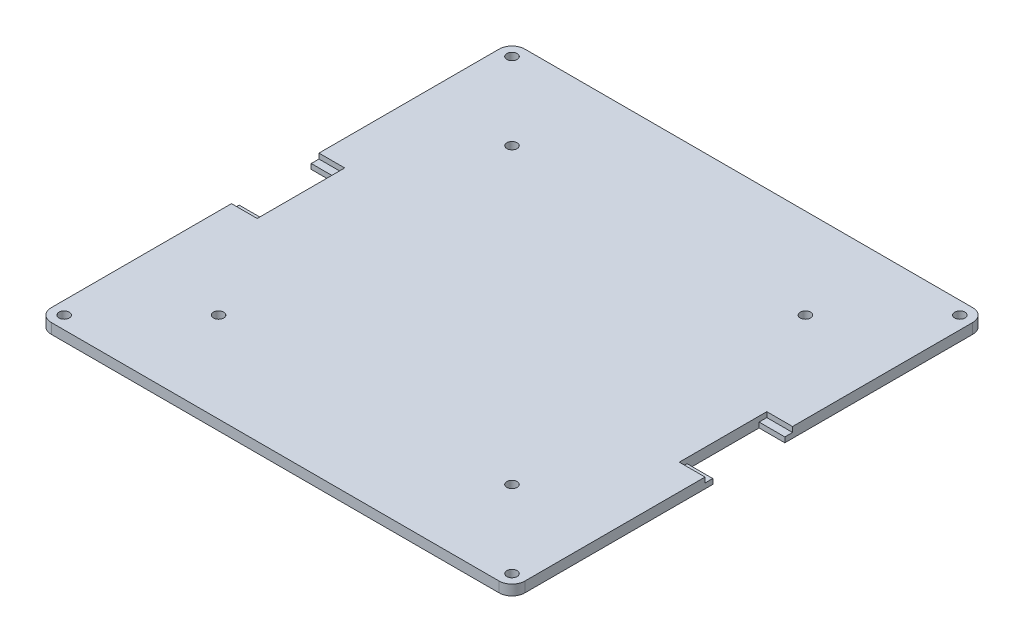
from build123d import *

# Parameters (mm, degrees)
BOSS_EXTRUDE1_DEPTH = 2
SKETCH7_W           = 5
SKETCH7_H           = 1.5
CUT_EXTRUDE1_DEPTH  = 1
SKETCH8_R           = 1
CUT_EXTRUDE2_DEPTH  = 5


with BuildPart() as part:
    # Sketch6 → Boss-Extrude1 (new body)
    with BuildSketch(Plane(origin=(0, -10, 0), x_dir=(1, 0, 0), z_dir=(0, 1, 0))):
        with BuildLine():
            Line((-46, -7), (-46, -43.5))
            ThreePointArc((-46, -43.5), (-45.267766953, -45.267766953), (-43.5, -46))
            Line((-43.5, -46), (43.5, -46))
            ThreePointArc((43.5, -46), (45.267766953, -45.267766953), (46, -43.5))
            Line((46, -43.5), (46, -7))
            Line((46, -7), (41, -7))
            Line((41, -7), (41, 7))
            Line((41, 7), (46, 7))
            Line((46, 7), (46, 43.5))
            ThreePointArc((46, 43.5), (45.267766953, 45.267766953), (43.5, 46))
            Line((43.5, 46), (-43.5, 46))
            ThreePointArc((-43.5, 46), (-45.267766953, 45.267766953), (-46, 43.5))
            Line((-46, 43.5), (-46, 7))
            Line((-46, 7), (-41, 7))
            Line((-41, 7), (-41, -7))
            Line((-41, -7), (-46, -7))
        make_face()
    extrude(amount=BOSS_EXTRUDE1_DEPTH)

    # Sketch7 → Cut-Extrude1 (cut)
    with BuildSketch(Plane(origin=(0, -8, 0), x_dir=(1, 0, 0), z_dir=(0, 1, 0))):
        with Locations((-43.5, 7.75)):
            Rectangle(SKETCH7_W, SKETCH7_H)
        with Locations((-43.5, -7.75)):
            Rectangle(SKETCH7_W, SKETCH7_H)
        with Locations((43.5, -7.75)):
            Rectangle(SKETCH7_W, SKETCH7_H)
        with Locations((43.5, 7.75)):
            Rectangle(SKETCH7_W, SKETCH7_H)
    extrude(amount=-CUT_EXTRUDE1_DEPTH, mode=Mode.SUBTRACT)

    # Sketch8 → Cut-Extrude2 (cut)
    with BuildSketch(Plane(origin=(0, -8, 0), x_dir=(1, 0, 0), z_dir=(0, 1, 0))):
        with Locations(Location((-43.5, 43.5, 0), (0, 0, 270))):
            Circle(SKETCH8_R)
        with Locations(Location((43.5, 43.5, 0), (0, 0, 270))):
            Circle(SKETCH8_R)
        with Locations(Location((-43.5, -43.5, 0), (0, 0, 270))):
            Circle(SKETCH8_R)
        with Locations(Location((43.5, -43.5, 0), (0, 0, 270))):
            Circle(SKETCH8_R)
        with Locations(Location((-28.5, 28.5, 0), (0, 0, 270))):
            Circle(SKETCH8_R)
        with Locations(Location((28.5, 28.5, 0), (0, 0, 270))):
            Circle(SKETCH8_R)
        with Locations(Location((-28.5, -28.5, 0), (0, 0, 270))):
            Circle(SKETCH8_R)
        with Locations(Location((28.5, -28.5, 0), (0, 0, 270))):
            Circle(SKETCH8_R)
    extrude(amount=-CUT_EXTRUDE2_DEPTH, mode=Mode.SUBTRACT)


solid = part.part
